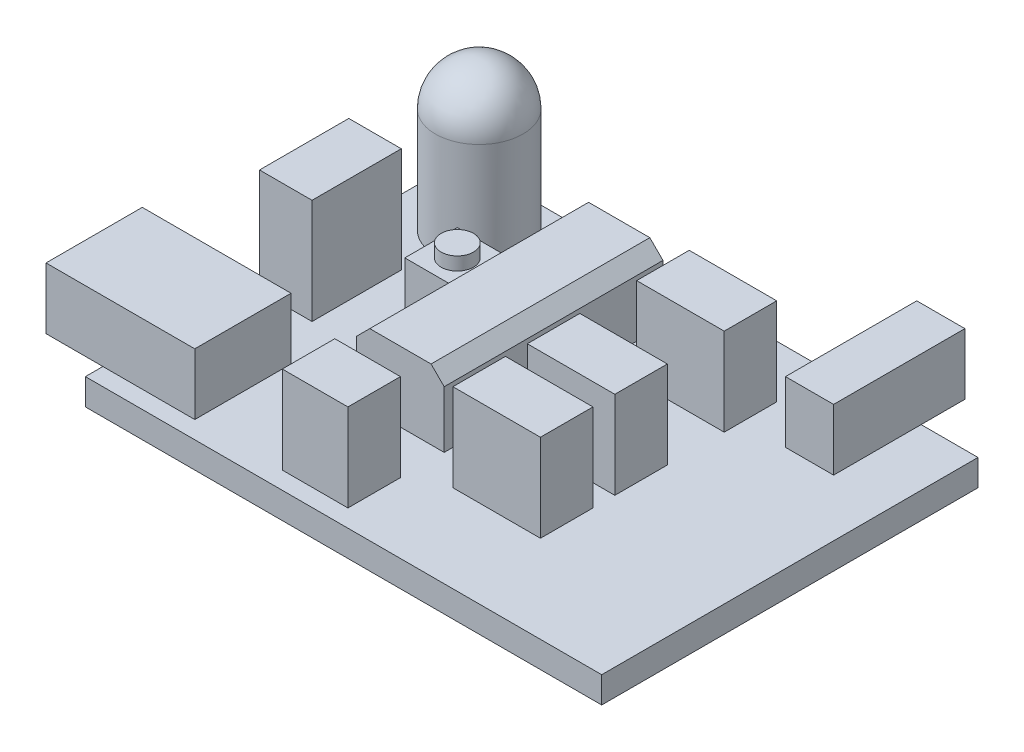
from build123d import *

# Parameters (mm, degrees)
SKETCH1_W           = 59
SKETCH1_H           = 43
BOSS_EXTRUDE1_DEPTH = 3
SKETCH2_R           = 5
BOSS_EXTRUDE2_DEPTH = 17
SKETCH3_W           = 17
SKETCH3_H           = 11
BOSS_EXTRUDE3_DEPTH = 7
SKETCH4_W           = 5.5
SKETCH4_H           = 15
BOSS_EXTRUDE4_DEPTH = 7
FILLET1_R           = 5
SKETCH5_W           = 7.5
SKETCH5_H           = 6
SKETCH5_W_2         = 10
BOSS_EXTRUDE5_DEPTH = 10
SKETCH6_W           = 6
SKETCH6_H           = 10.2
BOSS_EXTRUDE6_DEPTH = 12
SKETCH7_W           = 10
SKETCH7_H           = 25
BOSS_EXTRUDE7_DEPTH = 8
CHAMFER1_SIZE       = 1.5
SKETCH8_W           = 6
SKETCH8_H           = 6
BOSS_EXTRUDE8_DEPTH = 5
SKETCH9_R           = 1.85
BOSS_EXTRUDE9_DEPTH = 1.5


with BuildPart() as part:
    # Sketch1 → Boss-Extrude1 (new body)
    with BuildSketch(Plane(origin=(0, 0, 0), x_dir=(1, 0, 0), z_dir=(0, 1, 0))):
        Rectangle(SKETCH1_W, SKETCH1_H)
    extrude(amount=BOSS_EXTRUDE1_DEPTH)

    # Sketch2 → Boss-Extrude2 (add)
    with BuildSketch(Plane(origin=(0, 3, 0), x_dir=(1, 0, 0), z_dir=(0, 1, 0))):
        with Locations(Location((-21.5, 15.5, 0), (0, 0, 90))):
            Circle(SKETCH2_R)
    extrude(amount=BOSS_EXTRUDE2_DEPTH)

    # Sketch3 → Boss-Extrude3 (add)
    with BuildSketch(Plane(origin=(0, 3, 0), x_dir=(1, 0, 0), z_dir=(0, 1, 0))):
        with Locations((-27.5, -14)):
            Rectangle(SKETCH3_W, SKETCH3_H)
    extrude(amount=BOSS_EXTRUDE3_DEPTH)

    # Sketch4 → Boss-Extrude4 (add)
    with BuildSketch(Plane(origin=(0, 3, 0), x_dir=(1, 0, 0), z_dir=(0, 1, 0))):
        with Locations((20.25, 19)):
            Rectangle(SKETCH4_W, SKETCH4_H)
    extrude(amount=BOSS_EXTRUDE4_DEPTH)

    # Fillet1
    fillet1_edges = [part.edges().sort_by_distance(p)[0] for p in [
        (-21.5, 20, -10.5),
    ]]
    fillet(fillet1_edges, radius=FILLET1_R)

    # Sketch5 → Boss-Extrude5 (add)
    with BuildSketch(Plane(origin=(0, 3, 0), x_dir=(1, 0, 0), z_dir=(0, 1, 0))):
        with Locations((-5.25, -16.5)):
            Rectangle(SKETCH5_W, SKETCH5_H)
        with Locations((7.5, 12.5)):
            Rectangle(SKETCH5_W_2, SKETCH5_H)
        with Locations((7.5, 0)):
            Rectangle(SKETCH5_W_2, SKETCH5_H)
        with Locations((7.5, -8.5)):
            Rectangle(SKETCH5_W_2, SKETCH5_H)
    extrude(amount=BOSS_EXTRUDE5_DEPTH)

    # Sketch6 → Boss-Extrude6 (add)
    with BuildSketch(Plane(origin=(0, 3, 0), x_dir=(1, 0, 0), z_dir=(0, 1, 0))):
        with Locations((-25, 2)):
            Rectangle(SKETCH6_W, SKETCH6_H)
    extrude(amount=BOSS_EXTRUDE6_DEPTH)

    # Sketch7 → Boss-Extrude7 (add)
    with BuildSketch(Plane(origin=(0, 3, 0), x_dir=(1, 0, 0), z_dir=(0, 1, 0))):
        with Locations((-6.5, 4)):
            Rectangle(SKETCH7_W, SKETCH7_H)
    extrude(amount=BOSS_EXTRUDE7_DEPTH)

    # Chamfer1
    chamfer1_edges = [part.edges().sort_by_distance(p)[0] for p in [
        (-1.5, 11, -4),
        (-11.5, 11, -4),
    ]]
    chamfer(chamfer1_edges, length=CHAMFER1_SIZE)

    # Sketch8 → Boss-Extrude8 (add)
    with BuildSketch(Plane(origin=(0, 3, 0), x_dir=(1, 0, 0), z_dir=(0, 1, 0))):
        with Locations((-15, 6.5)):
            Rectangle(SKETCH8_W, SKETCH8_H)
    extrude(amount=BOSS_EXTRUDE8_DEPTH)

    # Sketch9 → Boss-Extrude9 (add)
    with BuildSketch(Plane(origin=(0, 8, 0), x_dir=(1, 0, 0), z_dir=(0, 1, 0))):
        with Locations(Location((-15, 6.5, 0), (0, 0, 90))):
            Circle(SKETCH9_R)
    extrude(amount=BOSS_EXTRUDE9_DEPTH)


solid = part.part
